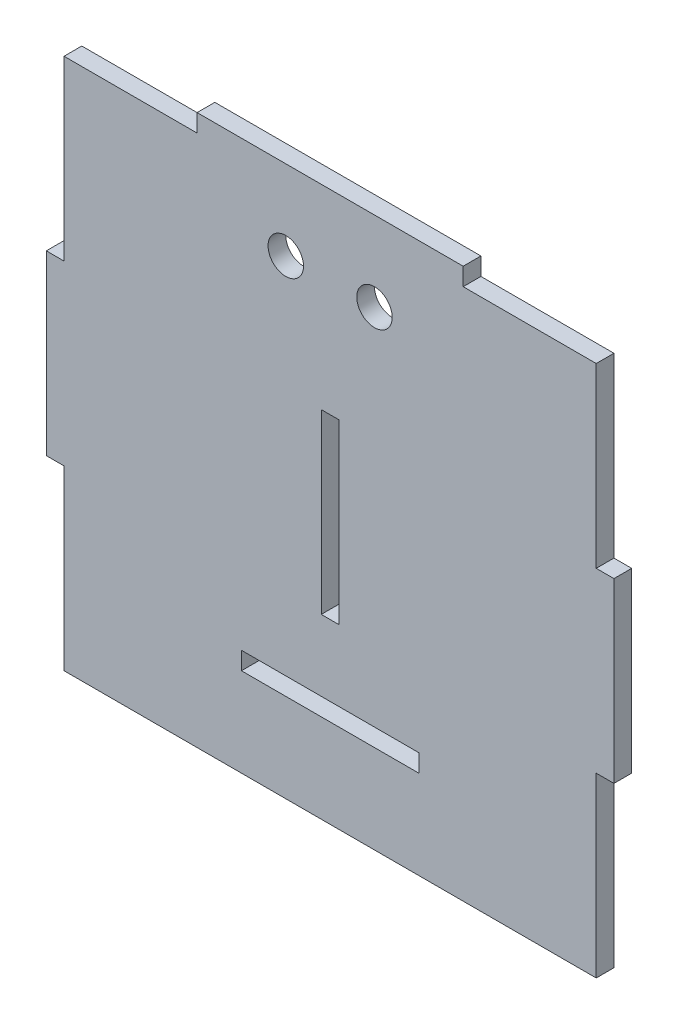
from build123d import *

# Parameters (mm, degrees)
SKETCH_2_W      = 60
SKETCH_2_H      = 60
SKETCH_2_R      = 2
SKETCH_2_W_2    = 20
SKETCH_2_H_2    = 2
SKETCH_2_W_3    = 2
SKETCH_2_H_3    = 20
SKETCH_2_W_4    = 30
EXTRUDE_1_DEPTH = 2


with BuildPart() as part:
    # 草图2 → 凸台-拉伸1 (new body)
    # profile 1 of 4: a face of its own
    with BuildSketch(Plane.XY):
        with Locations((30, 30)):
            Rectangle(SKETCH_2_W, SKETCH_2_H)
        with Locations((25, 53)):
            Circle(SKETCH_2_R, mode=Mode.SUBTRACT)
        with Locations((35, 53)):
            Circle(SKETCH_2_R, mode=Mode.SUBTRACT)
        with Locations((30, 11)):
            Rectangle(SKETCH_2_W_2, SKETCH_2_H_2, mode=Mode.SUBTRACT)
        with Locations((30, 30)):
            Rectangle(SKETCH_2_W_3, SKETCH_2_H_3, mode=Mode.SUBTRACT)
    # profile 2 of 4: a face of its own
    with BuildSketch(Plane.XY):
        with Locations((30, 61)):
            Rectangle(SKETCH_2_W_4, SKETCH_2_H_2)
    # profile 3 of 4: a face of its own
    with BuildSketch(Plane.XY):
        with Locations((-1, 30)):
            Rectangle(SKETCH_2_W_3, SKETCH_2_H_3)
    # profile 4 of 4: a face of its own
    with BuildSketch(Plane.XY):
        with Locations((61, 30)):
            Rectangle(SKETCH_2_W_3, SKETCH_2_H_3)
    extrude(amount=EXTRUDE_1_DEPTH)


solid = part.part
